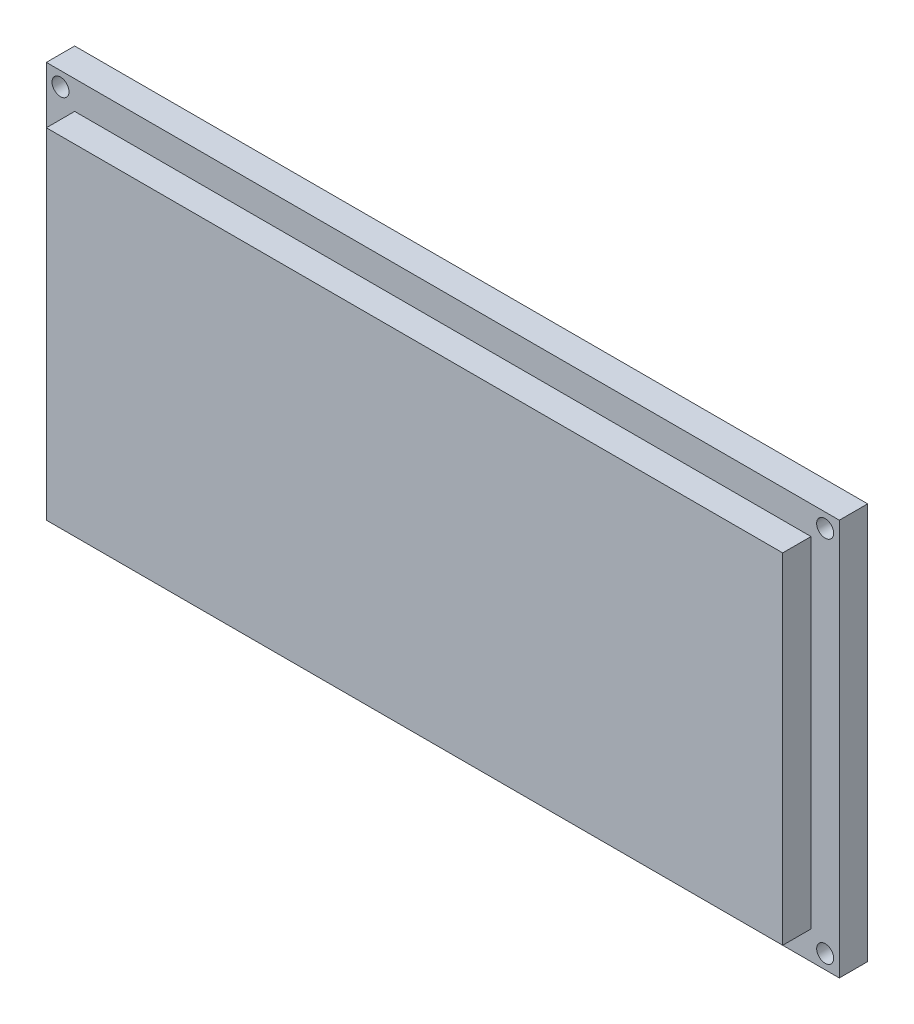
from build123d import *

# Parameters (mm, degrees)
SKETCH1_W            = 140
SKETCH1_H            = 70
BOSS_EXTRUDE1_DEPTH  = 5
SKETCH2_W            = 130
SKETCH2_H            = 60
BOSS_EXTRUDE2_DEPTH  = 5
M3_CLEARANCE_HOLE1_D = 3


with BuildPart() as part:
    # Sketch1 → Boss-Extrude1 (new body)
    with BuildSketch(Plane.XY):
        with Locations((70, 35)):
            Rectangle(SKETCH1_W, SKETCH1_H)
    extrude(amount=BOSS_EXTRUDE1_DEPTH)

    # Sketch2 → Boss-Extrude2 (add)
    with BuildSketch(Plane.XY.offset(5)):
        with Locations((70, 35)):
            Rectangle(SKETCH2_W, SKETCH2_H)
    extrude(amount=BOSS_EXTRUDE2_DEPTH)

    # M3 Clearance Hole1 (through all)
    with Locations(Plane(origin=(137.5, 2.5, 0), x_dir=(-1, 0, 0), z_dir=(0, 0, -1))):
        with Locations((0, 0), (0, 65), (135, 0), (135, 65)):
            Hole(M3_CLEARANCE_HOLE1_D / 2)


solid = part.part
